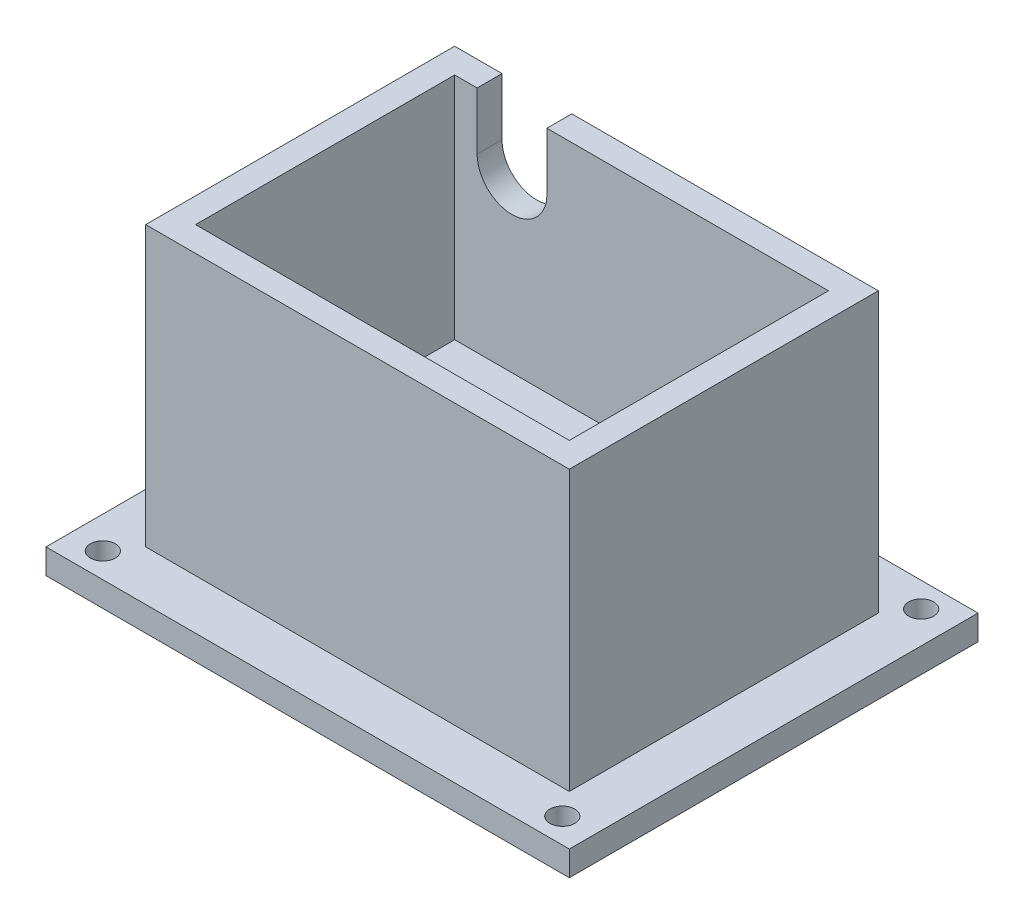
from build123d import *

# Parameters (mm, degrees)
SKETCH1_W           = 150
SKETCH1_H           = 104
BOSS_EXTRUDE1_DEPTH = 30
SKETCH2_W           = 170
SKETCH2_H           = 124
SKETCH2_W_2         = 150
SKETCH2_H_2         = 104
BOSS_EXTRUDE2_DEPTH = 122
CUT_EXTRUDE2_DEPTH  = 10
SKETCH6_W           = 210
SKETCH6_H           = 164
SKETCH6_R           = 5
BOSS_EXTRUDE3_DEPTH = 10


with BuildPart() as part:
    # Sketch1 → Boss-Extrude1 (new body)
    with BuildSketch(Plane(origin=(0, 0, 0), x_dir=(1, 0, 0), z_dir=(0, 1, 0))):
        with Locations((75, 52)):
            Rectangle(SKETCH1_W, SKETCH1_H)
    extrude(amount=BOSS_EXTRUDE1_DEPTH)

    # Sketch2 → Boss-Extrude2 (add)
    with BuildSketch(Plane(origin=(0, 0, 0), x_dir=(1, 0, 0), z_dir=(0, 1, 0))):
        with Locations((75, 52)):
            Rectangle(SKETCH2_W, SKETCH2_H)
        with Locations((75, 52)):
            Rectangle(SKETCH2_W_2, SKETCH2_H_2, mode=Mode.SUBTRACT)
    extrude(amount=BOSS_EXTRUDE2_DEPTH)

    # Sketch5 → Cut-Extrude2 (cut)
    with BuildSketch(Plane(origin=(0, 0, -114), x_dir=(-1, 0, 0), z_dir=(0, 0, -1))):
        with BuildLine():
            Line((-37, 122), (-37, 99))
            ThreePointArc((-37, 99), (-23, 85), (-9, 99))
            Line((-9, 99), (-9, 122))
            Line((-9, 122), (-37, 122))
        make_face()
    extrude(amount=-CUT_EXTRUDE2_DEPTH, mode=Mode.SUBTRACT)

    # Sketch6 → Boss-Extrude3 (add)
    with BuildSketch(Plane(origin=(0, 0, 0), x_dir=(1, 0, 0), z_dir=(0, 1, 0))):
        with Locations((75, 52)):
            Rectangle(SKETCH6_W, SKETCH6_H)
        with Locations(Location((-17.195121951, -20, 0), (0, 0, 270))):
            Circle(SKETCH6_R, mode=Mode.SUBTRACT)
        with Locations(Location((167.195121951, -20, 0), (0, 0, 270))):
            Circle(SKETCH6_R, mode=Mode.SUBTRACT)
        with Locations(Location((167.195121951, 124, 0), (0, 0, 270))):
            Circle(SKETCH6_R, mode=Mode.SUBTRACT)
        with Locations(Location((-17.195121951, 124, 0), (0, 0, 270))):
            Circle(SKETCH6_R, mode=Mode.SUBTRACT)
    extrude(amount=BOSS_EXTRUDE3_DEPTH)


solid = part.part
